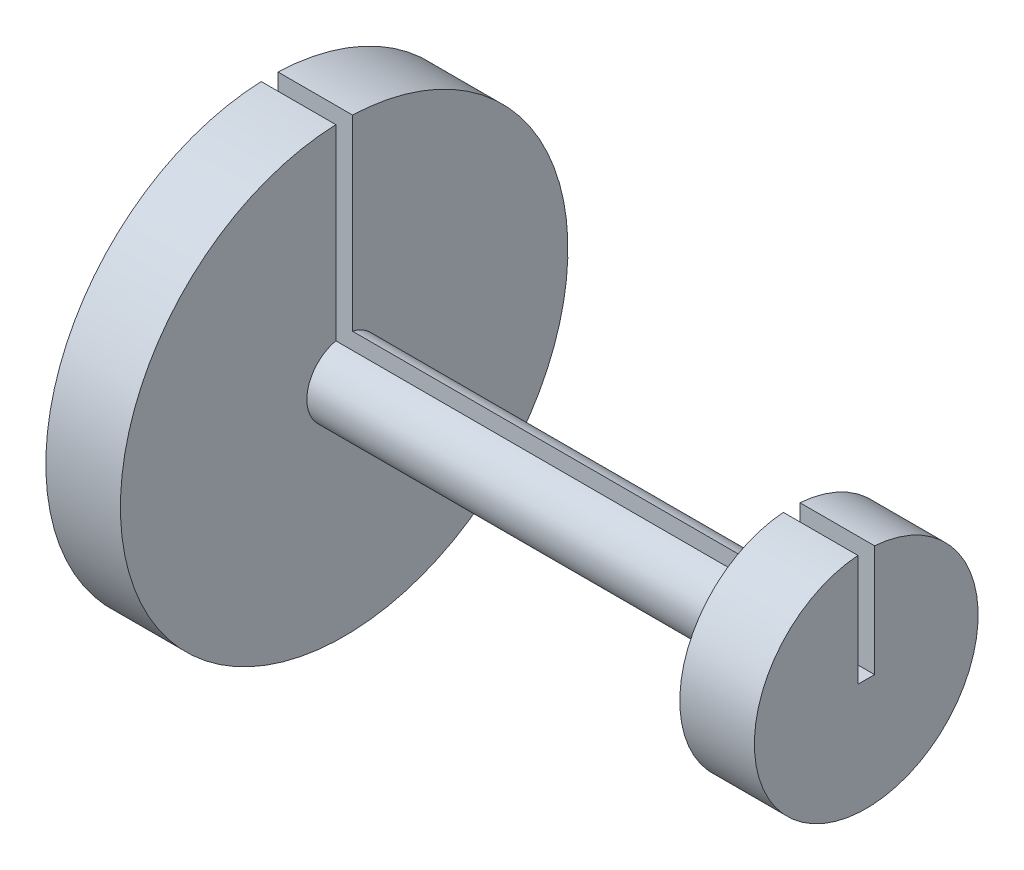
from build123d import *

# Parameters (mm, degrees)
SKETCH2_W          = 2.233127964
SKETCH2_H          = 31.607349632
CUT_EXTRUDE1_DEPTH = 80


with BuildPart() as part:
    # Sketch1 → Revolve1 (revolve)
    with BuildSketch(Plane.XY, mode=Mode.PRIVATE) as revolve1_sk:
        Polygon((0, 0), (0, 30), (10, 30), (10, 5), (70, 5), (70, 15), (80, 15), (80, 0), align=None)
    revolve(revolve1_sk.sketch.rotate(Axis((80, 0, 0), (-1, 0, 0)), 90), axis=Axis((80, 0, 0), (-1, 0, 0)))

    # Sketch2 → Cut-Extrude1 (cut)
    with BuildSketch(Plane(origin=(80, 0, 0), x_dir=(0, 0, -1), z_dir=(1, 0, 0))):
        with Locations((0, 15.803674816)):
            Rectangle(SKETCH2_W, SKETCH2_H)
    extrude(amount=-CUT_EXTRUDE1_DEPTH, mode=Mode.SUBTRACT)


solid = part.part
